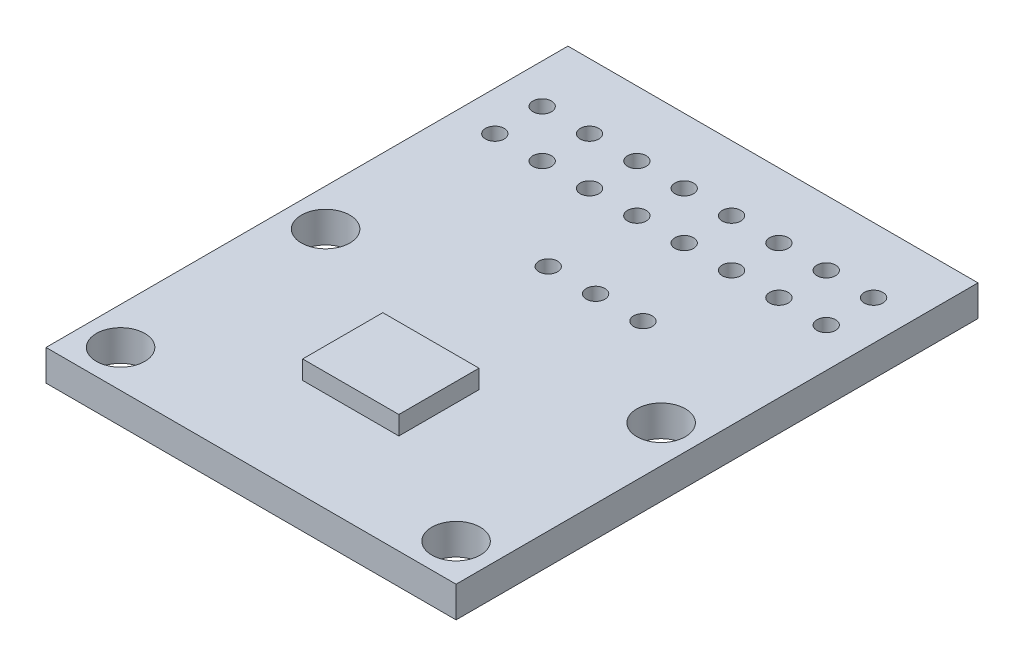
from build123d import *

# Parameters (mm, degrees)
SKETCH1_W                      = 22
SKETCH1_H                      = 28
BOSS_EXTRUDE1_DEPTH            = 1.66
SKETCH2_W                      = 5.16
SKETCH2_H                      = 4.3
BOSS_EXTRUDE2_DEPTH            = 1
F_2_6_2_6_DIAMETER_HOLE1_D     = 2.6
F_2_6_2_6_DIAMETER_HOLE1_DEPTH = 2.66
SKETCH6_R                      = 0.5
CUT_EXTRUDE1_DEPTH             = 18.881711327


with BuildPart() as part:
    # Sketch1 → Boss-Extrude1 (new body)
    with BuildSketch(Plane(origin=(0, 0.83, 0), x_dir=(1, 0, 0), z_dir=(0, 1, 0))):
        Rectangle(SKETCH1_W, SKETCH1_H)
    extrude(amount=-BOSS_EXTRUDE1_DEPTH)

    # Sketch2 → Boss-Extrude2 (add)
    with BuildSketch(Plane(origin=(0, 0.83, 0), x_dir=(-1, 0, 0), z_dir=(0, 1, 0))):
        with Locations((0, 6.5)):
            Rectangle(SKETCH2_W, SKETCH2_H)
    extrude(amount=BOSS_EXTRUDE2_DEPTH)

    # Ø2.6 (2.6) Diameter Hole1
    with Locations(Plane(origin=(0, -0.83, 0), x_dir=(-1, 0, 0), z_dir=(0, -1, 0))):
        with Locations((9, -1), (-9, -1), (9, -12), (-9, -12)):
            Hole(F_2_6_2_6_DIAMETER_HOLE1_D / 2, depth=F_2_6_2_6_DIAMETER_HOLE1_DEPTH)

    # Sketch6 → Cut-Extrude1 (cut, through all)
    with BuildSketch(Plane(origin=(0, 0.83, 0), x_dir=(1, 0, 0), z_dir=(0, 1, 0))):
        with Locations((-8.89, 10.508626005)):
            Circle(SKETCH6_R)
        with Locations((-8.89, 7.968626005)):
            Circle(SKETCH6_R)
        with Locations((-6.35, 10.508626005)):
            Circle(SKETCH6_R)
        with Locations((-6.35, 7.968626005)):
            Circle(SKETCH6_R)
        with Locations((-3.81, 10.508626005)):
            Circle(SKETCH6_R)
        with Locations((-3.81, 7.968626005)):
            Circle(SKETCH6_R)
        with Locations((-1.27, 10.508626005)):
            Circle(SKETCH6_R)
        with Locations((-1.27, 7.968626005)):
            Circle(SKETCH6_R)
        with Locations((1.27, 10.508626005)):
            Circle(SKETCH6_R)
        with Locations((1.27, 7.968626005)):
            Circle(SKETCH6_R)
        with Locations((3.81, 10.508626005)):
            Circle(SKETCH6_R)
        with Locations((3.81, 7.968626005)):
            Circle(SKETCH6_R)
        with Locations((6.35, 10.508626005)):
            Circle(SKETCH6_R)
        with Locations((6.35, 7.968626005)):
            Circle(SKETCH6_R)
        with Locations((8.89, 10.508626005)):
            Circle(SKETCH6_R)
        with Locations((8.89, 7.968626005)):
            Circle(SKETCH6_R)
        with Locations((-1.288362942, 3.232735908)):
            Circle(SKETCH6_R)
        with Locations((1.251637058, 3.232735908)):
            Circle(SKETCH6_R)
        with Locations((3.791637058, 3.232735908)):
            Circle(SKETCH6_R)
    extrude(amount=-CUT_EXTRUDE1_DEPTH, mode=Mode.SUBTRACT)


solid = part.part
